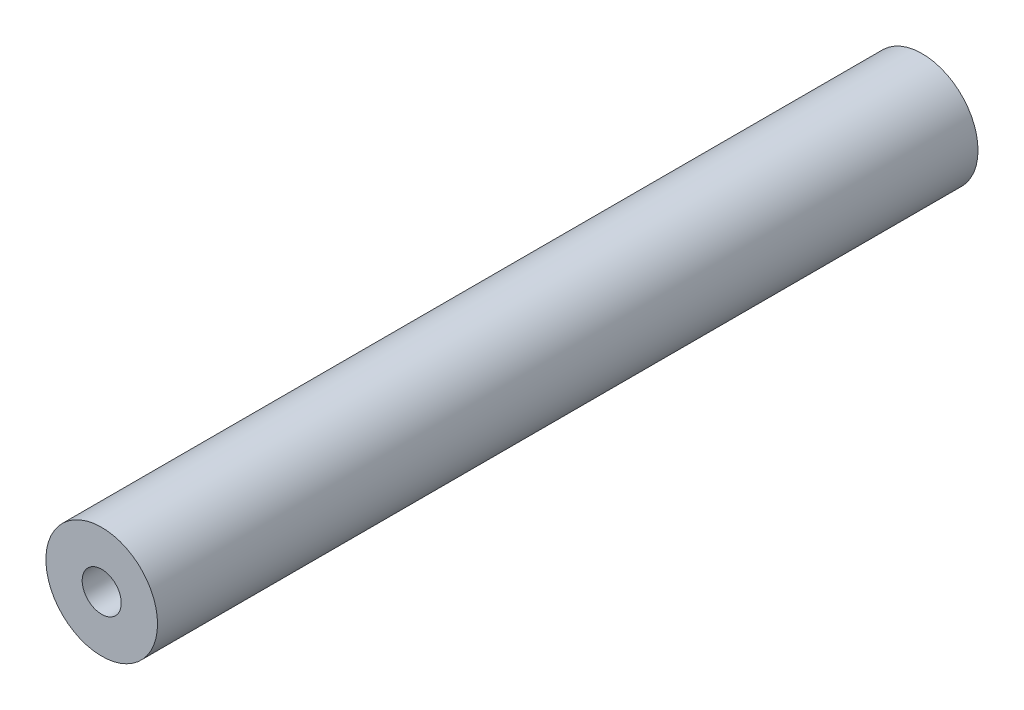
from build123d import *

# Parameters (mm, degrees)
SKETCH_1_R      = 5
SKETCH_1_R_2    = 1.75
EXTRUDE_1_DEPTH = 73.5


with BuildPart() as part:
    # 草图1 → 凸台-拉伸1 (new body)
    with BuildSketch(Plane.XY):
        Circle(SKETCH_1_R)
        Circle(SKETCH_1_R_2, mode=Mode.SUBTRACT)
    extrude(amount=EXTRUDE_1_DEPTH)


solid = part.part
